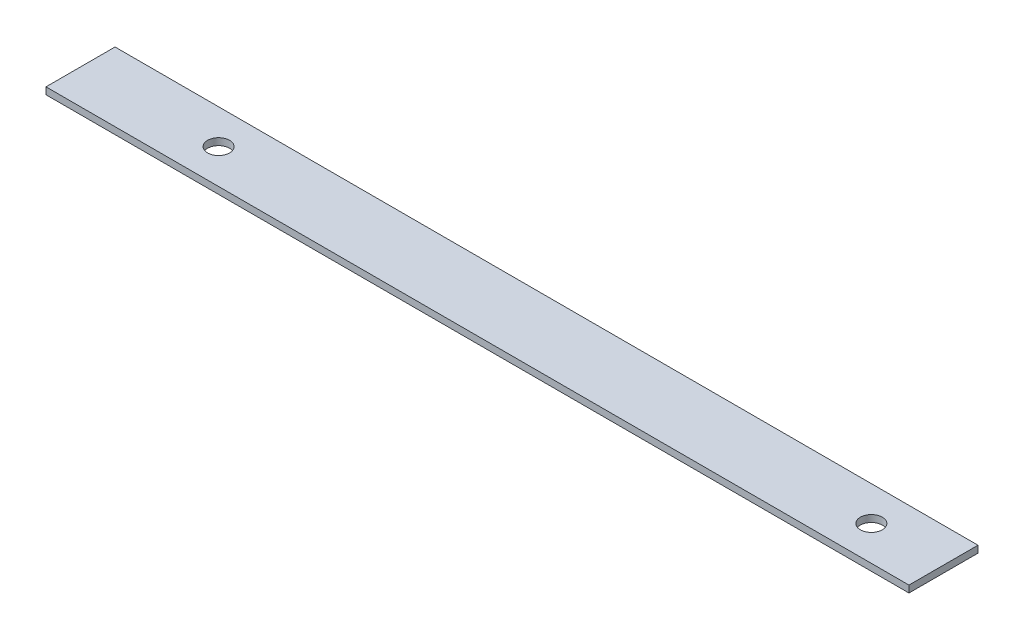
from build123d import *

# Parameters (mm, degrees)
SKETCH1_W           = 250
SKETCH1_H           = 20
BOSS_EXTRUDE1_DEPTH = 2
SKETCH6_R           = 3.175
CUT_EXTRUDE1_DEPTH  = 176.789246266


with BuildPart() as part:
    # Sketch1 → Boss-Extrude1 (new body)
    with BuildSketch(Plane(origin=(0, 0, 0), x_dir=(1, 0, 0), z_dir=(0, 1, 0))):
        with Locations((50.390966803, 1.656237233)):
            Rectangle(SKETCH1_W, SKETCH1_H)
    extrude(amount=BOSS_EXTRUDE1_DEPTH)

    # Sketch6 → Cut-Extrude1 (cut, through all)
    with BuildSketch(Plane.XZ):
        with Locations(Location((-34.609033197, -1.656237233, 0), (0, 0, 270))):
            Circle(SKETCH6_R)
        with Locations(Location((154.491966803, -1.656237233, 0), (0, 0, 270))):
            Circle(SKETCH6_R)
    extrude(amount=-CUT_EXTRUDE1_DEPTH, mode=Mode.SUBTRACT)


solid = part.part
